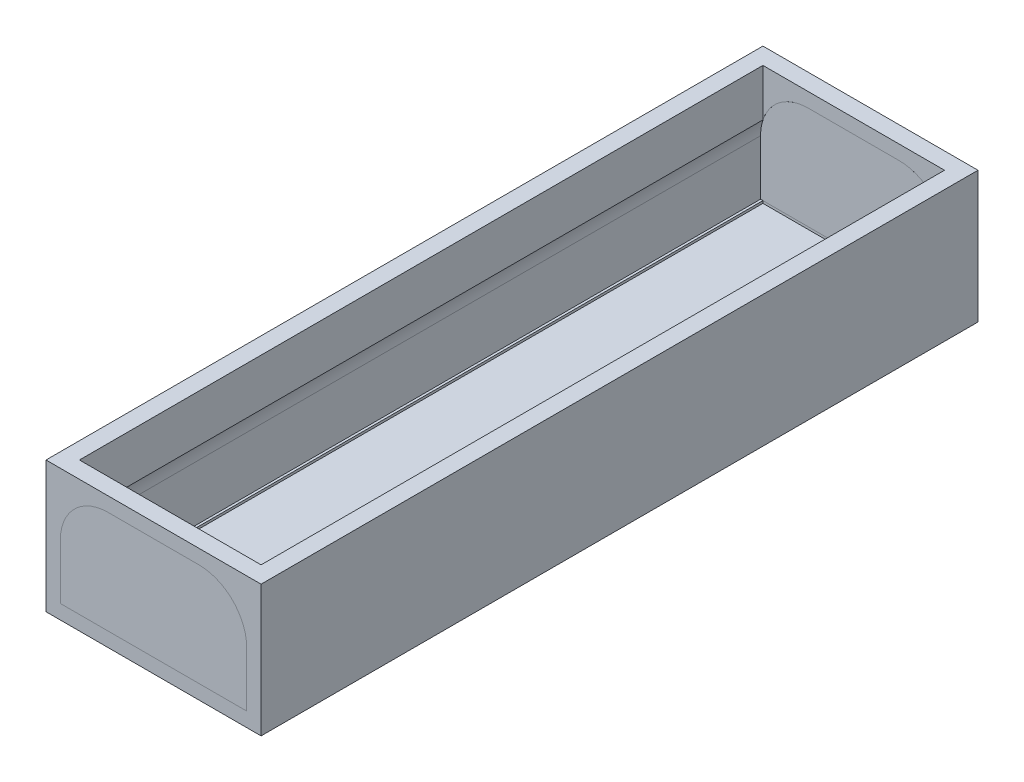
from build123d import *

# Parameters (mm, degrees)
ESQUISSE1_W             = 90
ESQUISSE1_H             = 55
BOSS_EXTRU_1_DEPTH      = 300
ESQUISSE3_W             = 76
ESQUISSE3_H             = 286
ENL_V_MAT_EXTRU_1_DEPTH = 50
ENL_V_MAT_EXTRU_2_DEPTH = 475
BOSS_EXTRU_2_DEPTH      = 5


with BuildPart() as part:
    # Esquisse1 → Boss.-Extru.1 (new body)
    with BuildSketch(Plane.XY):
        Rectangle(ESQUISSE1_W, ESQUISSE1_H)
    extrude(amount=BOSS_EXTRU_1_DEPTH)

    # Esquisse3 → Enlèv. mat.-Extru.1 (cut)
    with BuildSketch(Plane(origin=(0, 27.5, 0), x_dir=(1, 0, 0), z_dir=(0, 1, 0))):
        with Locations((0, -150)):
            Rectangle(ESQUISSE3_W, ESQUISSE3_H)
    extrude(amount=-ENL_V_MAT_EXTRU_1_DEPTH, mode=Mode.SUBTRACT)

    # Esquisse4 → Enlèv. mat.-Extru.2 (cut)
    with BuildSketch(Plane.XY.offset(300)):
        with BuildLine():
            Line((-39, 1.5), (-39, -21.5))
            Line((-39, -21.5), (39, -21.5))
            Line((39, -21.5), (39, 1.5))
            ThreePointArc((39, 1.5), (33.142135624, 15.642135624), (19, 21.5))
            Line((19, 21.5), (-19, 21.5))
            ThreePointArc((-19, 21.5), (-33.142135624, 15.642135624), (-39, 1.5))
        make_face()
    extrude(amount=-ENL_V_MAT_EXTRU_2_DEPTH, mode=Mode.SUBTRACT)


with BuildPart() as body_2:
    # Esquisse5 → Boss.-Extru.2 (new body)
    with BuildSketch(Plane.XY.offset(300)):
        with BuildLine():
            Line((-39, 1.5), (-39, -21.5))
            Line((-39, -21.5), (39, -21.5))
            Line((39, -21.5), (39, 1.5))
            ThreePointArc((39, 1.5), (33.142135624, 15.642135624), (19, 21.5))
            Line((19, 21.5), (-19, 21.5))
            ThreePointArc((-19, 21.5), (-33.142135624, 15.642135624), (-39, 1.5))
        make_face()
    extrude(amount=-BOSS_EXTRU_2_DEPTH)


with BuildPart() as body_3:
    # Symétrie2: mirrored copy
    add(body_2.part.mirror(Plane(origin=(0, 0, 151), x_dir=(1, 0, 0), z_dir=(0, 0, -1))))


solid = Compound([part.part, body_2.part, body_3.part])
